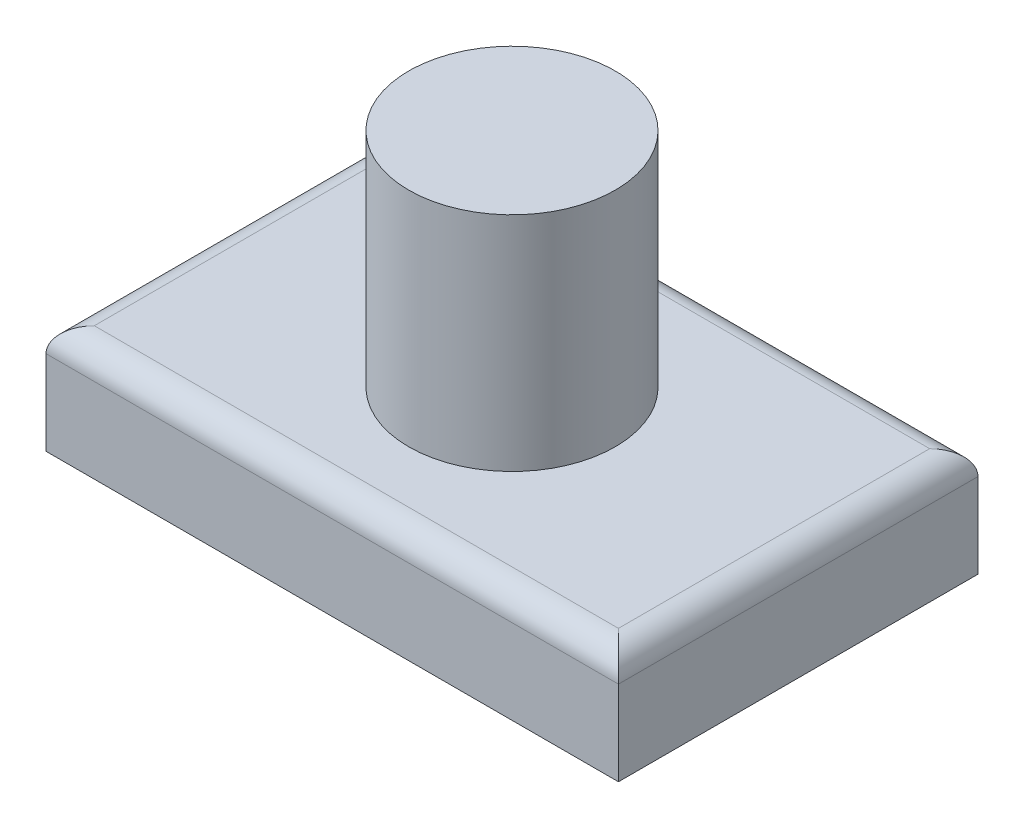
from build123d import *

# Parameters (mm, degrees)
SKETCH1_W           = 180.528529484
SKETCH1_H           = 113.389820172
BOSS_EXTRUDE1_DEPTH = 34.29
SKETCH3_R           = 32.56870091
BOSS_EXTRUDE2_DEPTH = 70.104
FILLET1_R           = 7.62


with BuildPart() as part:
    # Sketch1 → Boss-Extrude1 (new body)
    with BuildSketch(Plane(origin=(0, 0, 0), x_dir=(1, 0, 0), z_dir=(0, 1, 0))):
        Rectangle(SKETCH1_W, SKETCH1_H)
    extrude(amount=BOSS_EXTRUDE1_DEPTH)

    # Sketch3 → Boss-Extrude2 (add)
    with BuildSketch(Plane(origin=(0, 34.29, 0), x_dir=(1, 0, 0), z_dir=(0, 1, 0))):
        Circle(SKETCH3_R)
    extrude(amount=BOSS_EXTRUDE2_DEPTH)

    # Fillet1
    fillet1_edges = [part.edges().sort_by_distance(p)[0] for p in [
        (0, 34.29, 56.694910086),
        (0, 34.29, -56.694910086),
        (90.264264742, 34.29, 0),
        (-90.264264742, 34.29, 0),
    ]]
    fillet(fillet1_edges, radius=FILLET1_R)


solid = part.part
